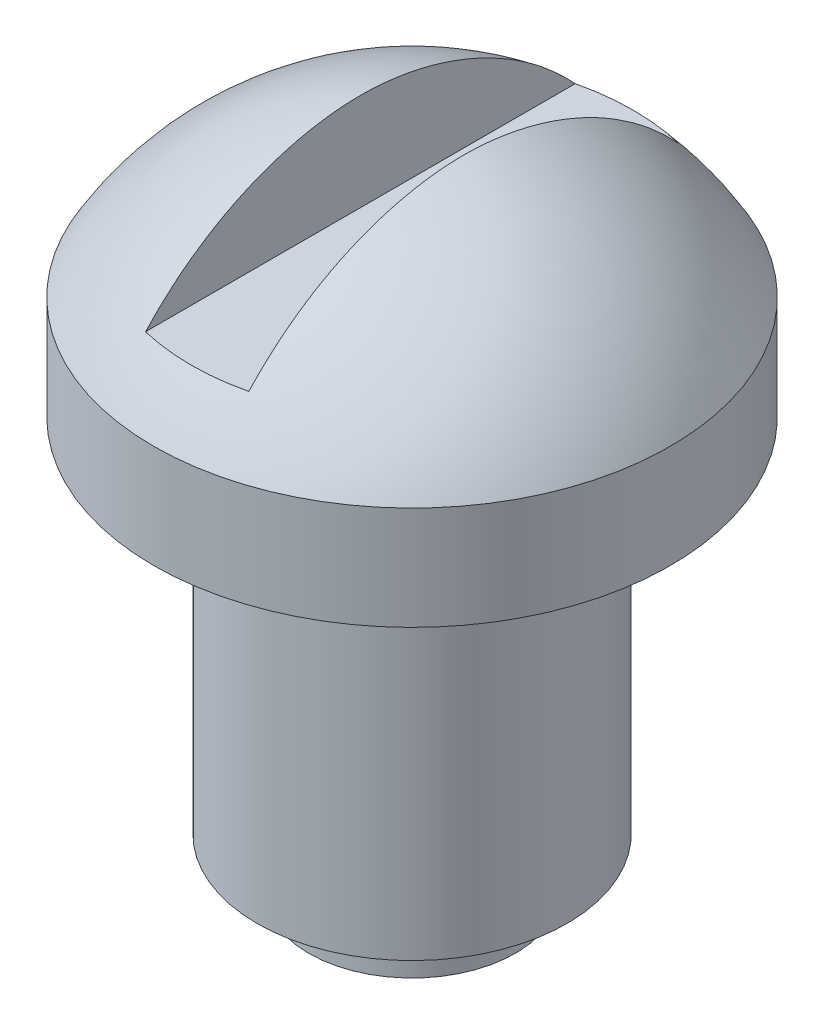
from build123d import *

# Parameters (mm, degrees)
CUT_EXTRUDE1_DEPTH      = 65.870739766
CUT_EXTRUDE1_DEPTH_BACK = 65.870739766
SKETCH2_W               = 2
SKETCH2_H               = 2


with BuildPart() as part:
    # Sketch1 → Revolve2 (revolve)
    with BuildSketch(Plane.XY, mode=Mode.PRIVATE) as revolve2_sk:
        with BuildLine():
            Line((0, -64.484206406), (2, -64.484206406))
            Line((2, -64.484206406), (2, -63.484206406))
            Line((2, -63.484206406), (3, -63.484206406))
            Line((3, -63.484206406), (3, -56.484206406))
            Line((3, -56.484206406), (5, -56.484206406))
            Line((5, -56.484206406), (5, -54.484206406))
            ThreePointArc((5, -54.484206406), (2.888936029, -52.33597969), (0, -51.484206406))
            Line((0, -51.484206406), (0, -64.44100966))
            Line((0, -64.44100966), (0, -64.484206406))
        make_face()
    revolve(revolve2_sk.sketch.rotate(Axis((0, 49.98015998, 0), (0, -1, 0)), 90), axis=Axis((0, 49.98015998, 0), (0, -1, 0)))

    # Sketch2 → Cut-Extrude1 (cut, two sides: drawn at the far end of the back side and taken through both)
    with BuildSketch(Plane.XY.offset(-CUT_EXTRUDE1_DEPTH_BACK)):
        with Locations((0, -52.484206406)):
            Rectangle(SKETCH2_W, SKETCH2_H)
    extrude(amount=CUT_EXTRUDE1_DEPTH + CUT_EXTRUDE1_DEPTH_BACK, mode=Mode.SUBTRACT)


solid = part.part
